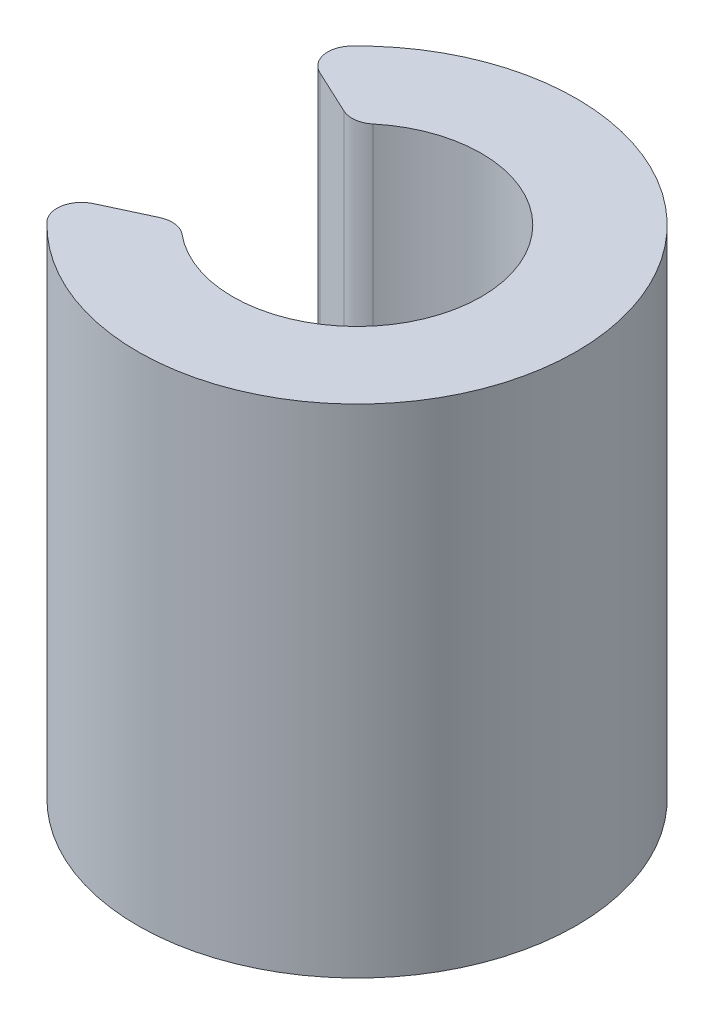
from build123d import *

# Parameters (mm, degrees)
BOSS_EXTRUDE1_DEPTH = 20.4
FILLET1_R           = 1


with BuildPart() as part:
    # Sketch1 → Boss-Extrude1 (new body)
    with BuildSketch(Plane(origin=(0, 0, 0), x_dir=(1, 0, 0), z_dir=(0, 1, 0))):
        with BuildLine():
            Line((-3.709447398, -3.5), (-7.348069674, -5.196717432))
            ThreePointArc((-7.348069674, -5.196717432), (9, 0), (-7.348069674, 5.196717432))
            Line((-7.348069674, 5.196717432), (-3.709447398, 3.5))
            ThreePointArc((-3.709447398, 3.5), (5.1, 0), (-3.709447398, -3.5))
        make_face()
    extrude(amount=BOSS_EXTRUDE1_DEPTH)

    # Fillet1
    fillet1_edges = [part.edges().sort_by_distance(p)[0] for p in [
        (-3.709447398, 10.2, -3.5),
        (-7.348069674, 10.2, -5.196717432),
        (-7.348069674, 10.2, 5.196717432),
        (-3.709447398, 10.2, 3.5),
    ]]
    fillet(fillet1_edges, radius=FILLET1_R)


solid = part.part
